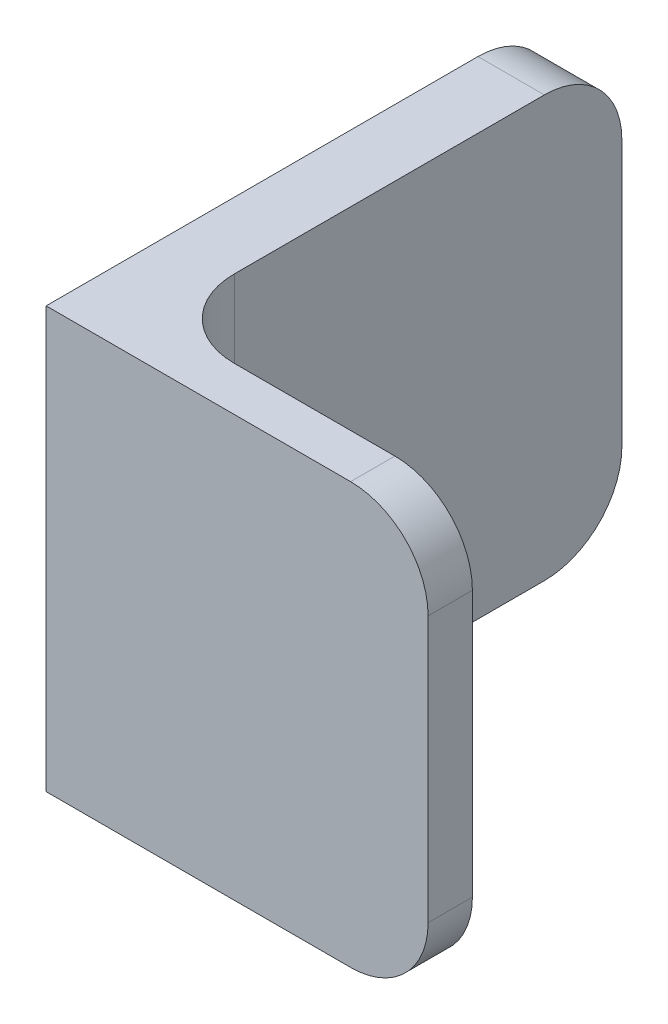
from build123d import *

# Parameters (mm, degrees)
BOSS_EXTRUDE1_DEPTH = 38
FILLET2_R           = 7


with BuildPart() as part:
    # Sketch1 → Boss-Extrude1 (new body)
    with BuildSketch(Plane(origin=(0, 0, 0), x_dir=(1, 0, 0), z_dir=(0, 1, 0))):
        Polygon((0, 0), (0, 46), (6, 46), (6, 4), (34.5, 4), (34.5, 0), align=None)
    extrude(amount=BOSS_EXTRUDE1_DEPTH)

    # Fillet2
    fillet2_edges = [part.edges().sort_by_distance(p)[0] for p in [
        (6, 19, -4),
        (3, 38, -46),
        (3, 0, -46),
        (34.5, 0, -2),
        (34.5, 38, -2),
    ]]
    fillet(fillet2_edges, radius=FILLET2_R)


solid = part.part
